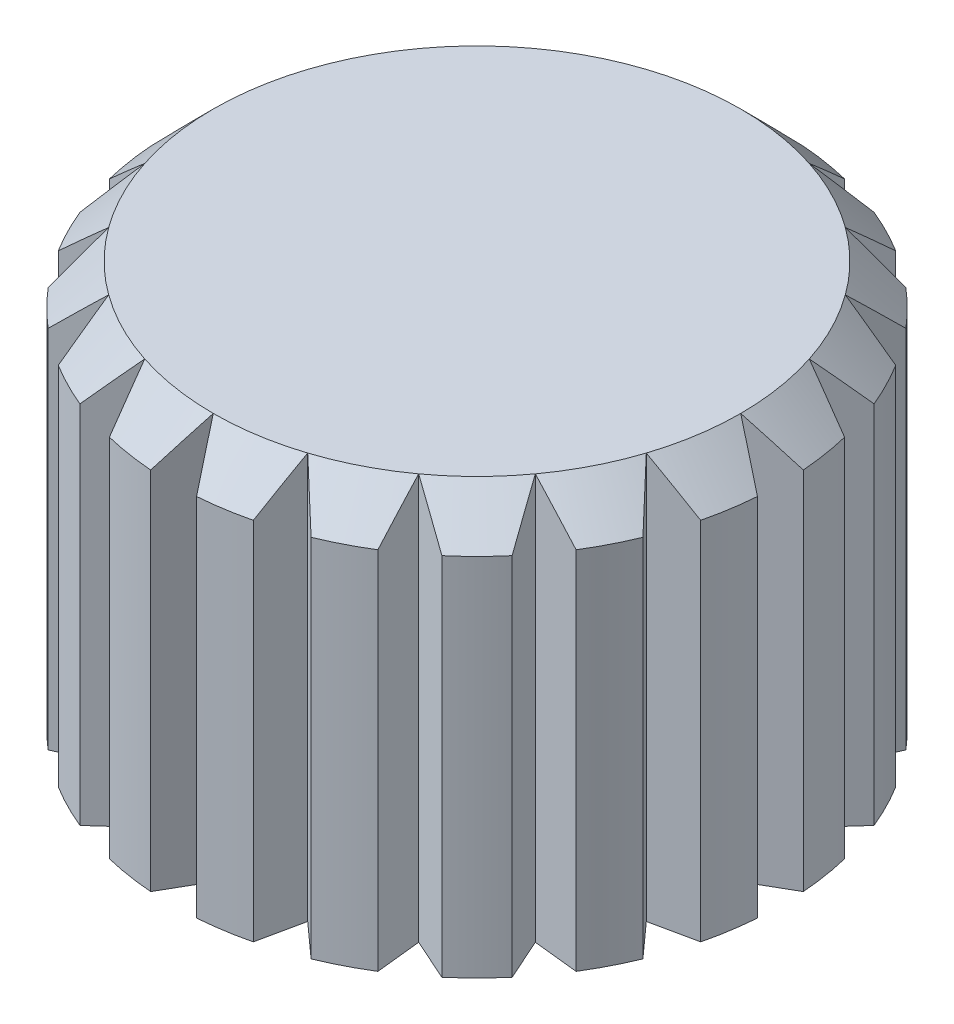
from build123d import *

# Parameters (mm, degrees)
CUT_EXTRUDE1_DEPTH = 10
CIRPATTERN1_COUNT  = 20


with BuildPart() as part:
    # Sketch1 → Revolve1 (revolve)
    with BuildSketch(Plane.XY, mode=Mode.PRIVATE) as revolve1_sk:
        Polygon((0, 8), (0, 10), (7.5, 10), (7.5, 0), (4, 0), (4, 5), (3.05, 5), (3.05, 8), align=None)
    revolve(revolve1_sk.sketch.rotate(Axis((0, 0, 0), (0, 1, 0)), 90), axis=Axis((0, 0, 0), (0, 1, 0)))

    # Sketch2 → Cut-Extrude1 (cut)
    with BuildSketch(Plane(origin=(0, 10, 0), x_dir=(1, 0, 0), z_dir=(0, 1, 0))):
        Polygon((0, 8.5), (1.154700538, 8.5), (0, 6.5), (-1.154700538, 8.5), align=None)
    cut_extrude1 = extrude(amount=-CUT_EXTRUDE1_DEPTH, mode=Mode.SUBTRACT)

    # CirPattern1: Cut-Extrude1 ×20 about axis
    cirpattern1_axis = Axis((0, 0, 0), (0, 1, 0))
    for i in range(1, CIRPATTERN1_COUNT):
        add(cut_extrude1.rotate(cirpattern1_axis, i * 360 / CIRPATTERN1_COUNT), mode=Mode.SUBTRACT)

    # Sketch3 → Cut-Revolve1 (revolve, cut)
    with BuildSketch(Plane.XY):
        Polygon((-8, 8.5), (-6, 10.5), (-8, 10.5), align=None)
    revolve(axis=Axis((0, 0, 0), (0, 1, 0)), mode=Mode.SUBTRACT)


solid = part.part
